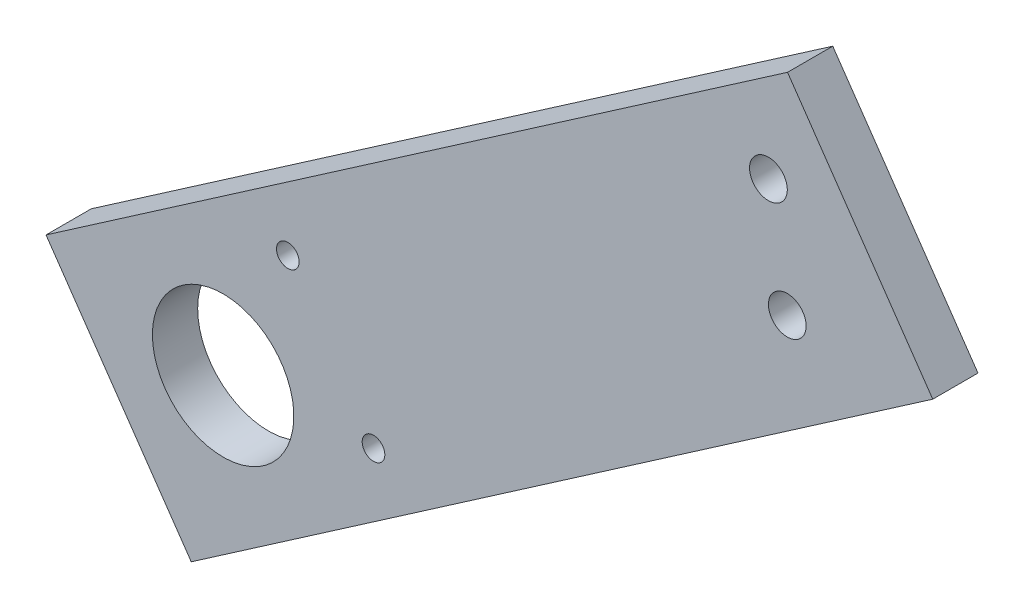
from build123d import *

# Parameters (mm, degrees)
SKETCH1_R           = 1.27
SKETCH1_R_2         = 4.7625
SKETCH1_R_3         = 0.762
BOSS_EXTRUDE1_DEPTH = 3.048


with BuildPart() as part:
    # Sketch1 → Boss-Extrude1 (new body)
    with BuildSketch(Plane.XY):
        Polygon((552.957131224, 142.871693799), (562.737035343, 128.696327154), (512.803524332, 94.246075371), (503.023620213, 108.421442016), align=None)
        with Locations(Location((551.672296834, 136.012198904, 0), (0, 0, 180))):
            Circle(SKETCH1_R, mode=Mode.SUBTRACT)
        with Locations(Location((552.942296834, 128.696327154, 0), (0, 0, 180))):
            Circle(SKETCH1_R, mode=Mode.SUBTRACT)
        with Locations(Location((514.95104564, 106.189069777, 0), (0, 0, 180))):
            Circle(SKETCH1_R_2, mode=Mode.SUBTRACT)
        with Locations(Location((519.308599463, 115.367159158, 0), (0, 0, 180))):
            Circle(SKETCH1_R_3, mode=Mode.SUBTRACT)
        with Locations(Location((525.078281113, 107.004362159, 0), (0, 0, 180))):
            Circle(SKETCH1_R_3, mode=Mode.SUBTRACT)
    extrude(amount=BOSS_EXTRUDE1_DEPTH)


solid = part.part
